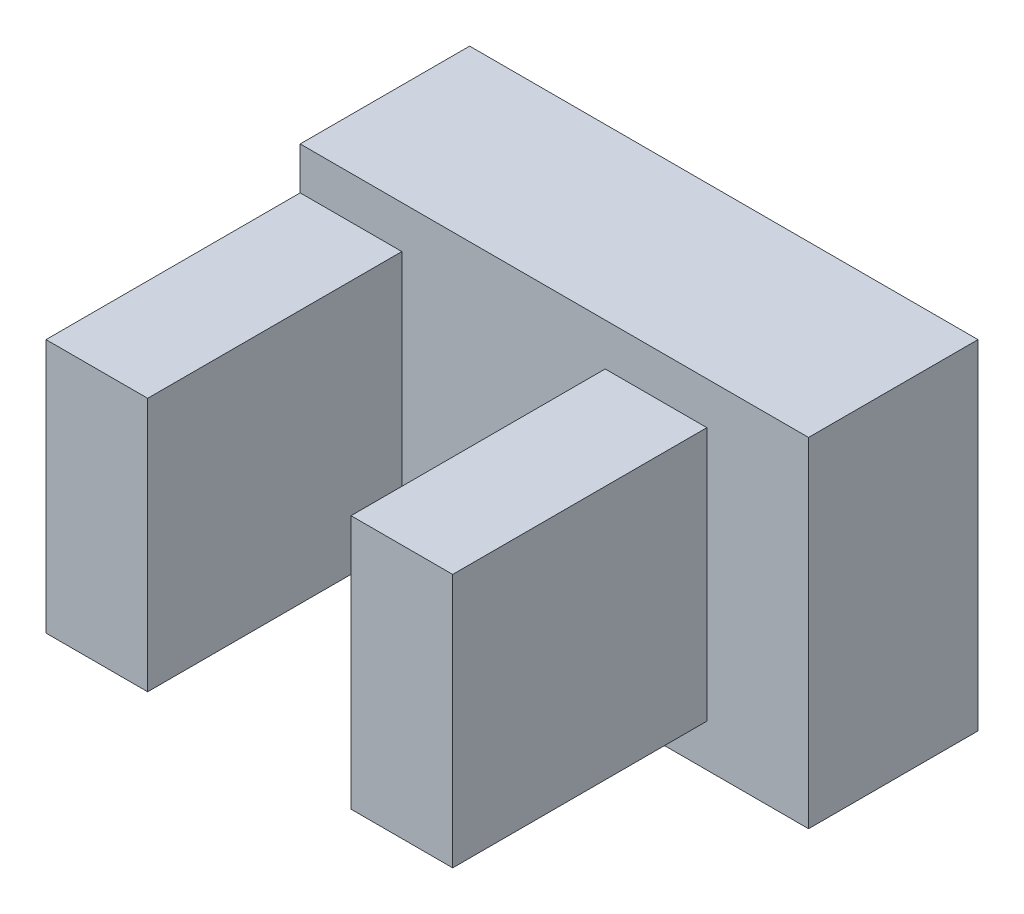
from build123d import *

# Parameters (mm, degrees)
SKETCH_8_W      = 60
SKETCH_8_H      = 40
EXTRUDE_1_DEPTH = 20
SKETCH_9_W      = 12
SKETCH_9_H      = 30
EXTRUDE_2_DEPTH = 30
SKETCH_10_W     = 12
SKETCH_10_H     = 30
EXTRUDE_3_DEPTH = 30


with BuildPart() as part:
    # 草图8 → 凸台-拉伸1 (new body)
    with BuildSketch(Plane.XY):
        Rectangle(SKETCH_8_W, SKETCH_8_H)
    extrude(amount=EXTRUDE_1_DEPTH)

    # 草图9 → 凸台-拉伸2 (add)
    with BuildSketch(Plane.XY.offset(20)):
        with Locations((-24, 0)):
            Rectangle(SKETCH_9_W, SKETCH_9_H)
    extrude(amount=EXTRUDE_2_DEPTH)

    # 草图10 → 凸台-拉伸3 (add)
    with BuildSketch(Plane.XY.offset(20)):
        with Locations((12, 0)):
            Rectangle(SKETCH_10_W, SKETCH_10_H)
    extrude(amount=EXTRUDE_3_DEPTH)


solid = part.part
